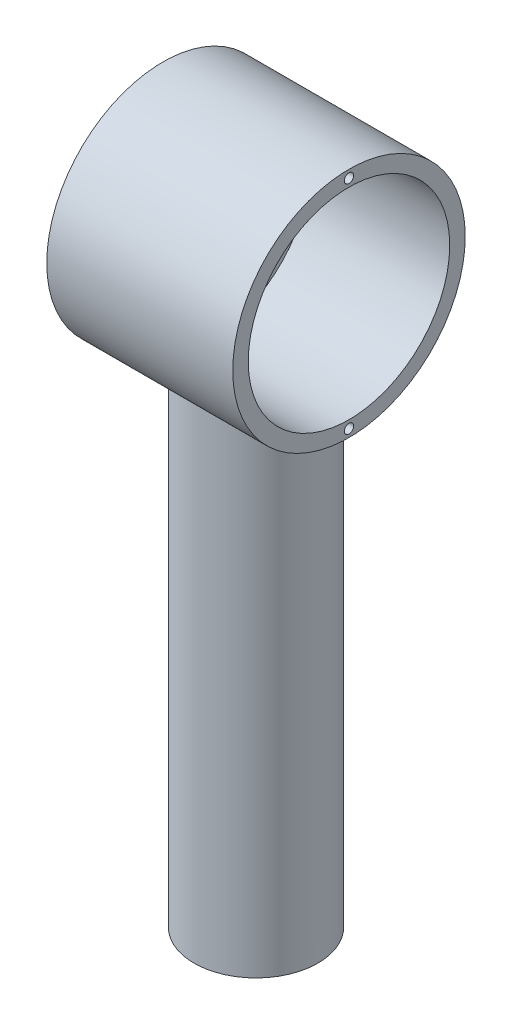
from build123d import *

# Parameters (mm, degrees)
SKETCH1_R                 = 20
BOSS_EXTRUDE1_DEPTH       = 25
BOSS_EXTRUDE2_START       = 100
SKETCH2_R                 = 20
BOSS_EXTRUDE2_DEPTH       = 100
BOSS_EXTRUDE4_START       = -100
SKETCH6_R                 = 20
BOSS_EXTRUDE4_DEPTH       = 100
SKETCH7_R                 = 25
CUT_EXTRUDE2_DEPTH        = 40
SKETCH8_R                 = 25
SKETCH8_R_2               = 22.5
BOSS_EXTRUDE7_DEPTH       = 40
SKETCH9_R                 = 25
BOSS_EXTRUDE8_DEPTH       = 2
BOSS_EXTRUDE10_DEPTH      = 38
CUT_EXTRUDE3_DEPTH        = 25
SKETCH12_R                = 25
CUT_EXTRUDE4_DEPTH        = 75
BOSS_EXTRUDE11_START      = 50
SKETCH14_R                = 20
BOSS_EXTRUDE11_DEPTH      = 50
BOSS_EXTRUDE12_DEPTH      = 10
BOSS_EXTRUDE12_DEPTH_BACK = 50
SKETCH13_R                = 37.5
SKETCH17_R                = 32.5
CUT_EXTRUDE5_DEPTH        = 50
BOSS_EXTRUDE13_START      = 2
SKETCH18_R                = 37.5
SKETCH18_R_2              = 32.5
BOSS_EXTRUDE13_DEPTH      = 2
SKETCH21_R                = 37.5
SKETCH21_R_2              = 32.5
CUT_EXTRUDE6_DEPTH        = 2
SKETCH22_R                = 1.5
CUT_EXTRUDE7_DEPTH        = 10
BOSS_EXTRUDE14_START      = 5
SKETCH27_R                = 32.5
BOSS_EXTRUDE14_DEPTH      = 5


with BuildPart() as part:
    # Sketch1 → Boss-Extrude1 (new body)
    with BuildSketch(Plane(origin=(0, 0, 0), x_dir=(1, 0, 0), z_dir=(0, 1, 0))):
        with Locations(Location((0, 0, 0), (0, 0, 270))):
            Circle(SKETCH1_R)
        Polygon((14.43375673, 0), (7.216878365, 12.5), (-7.216878365, 12.5), (-14.43375673, 0), (-7.216878365, -12.5), (7.216878365, -12.5), align=None, mode=Mode.SUBTRACT)
    extrude(amount=BOSS_EXTRUDE1_DEPTH)

    # Sketch2 → Boss-Extrude2 (add)
    with BuildSketch(Plane.XZ.offset(BOSS_EXTRUDE2_START)):
        with Locations(Location((0, 0, 0), (0, 0, 270))):
            Circle(SKETCH2_R)
    extrude(amount=-BOSS_EXTRUDE2_DEPTH)

    # Sketch6 → Boss-Extrude4 (add)
    with BuildSketch(Plane(origin=(0, 25, 0), x_dir=(1, 0, 0), z_dir=(0, 1, 0)).offset(BOSS_EXTRUDE4_START)):
        with Locations(Location((0, 0, 0), (0, 0, 90))):
            Circle(SKETCH6_R)
    extrude(amount=BOSS_EXTRUDE4_DEPTH)

    # Sketch7 → Cut-Extrude2 (cut)
    with BuildSketch(Plane(origin=(20, 0, 0), x_dir=(0, 0, -1), z_dir=(1, 0, 0))):
        with Locations((0, 39.286563349)):
            Circle(SKETCH7_R)
    extrude(amount=-CUT_EXTRUDE2_DEPTH, mode=Mode.SUBTRACT)

    # Sketch8 → Boss-Extrude7 (add)
    with BuildSketch(Plane(origin=(20, 0, 0), x_dir=(0, 0, -1), z_dir=(1, 0, 0))):
        with Locations((0, 39.252781264)):
            Circle(SKETCH8_R)
        with Locations((0, 39.252781264)):
            Circle(SKETCH8_R_2, mode=Mode.SUBTRACT)
    extrude(amount=-BOSS_EXTRUDE7_DEPTH)

    # Sketch9 → Boss-Extrude8 (add)
    with BuildSketch(Plane(origin=(20, 0, 0), x_dir=(0, 0, -1), z_dir=(1, 0, 0))):
        with Locations((0, 39.252781264)):
            Circle(SKETCH9_R)
    extrude(amount=-BOSS_EXTRUDE8_DEPTH)

    # Sketch10 → Boss-Extrude10 (add)
    with BuildSketch(Plane.ZY.offset(-18)):
        with BuildLine():
            Line((-15.081099266, 22.555163323), (15.081099266, 22.555163323))
            ThreePointArc((15.081099266, 22.555163323), (0, 16.752781264), (-15.081099266, 22.555163323))
        make_face()
    extrude(amount=BOSS_EXTRUDE10_DEPTH)

    # Sketch11 → Cut-Extrude3 (cut)
    with BuildSketch(Plane.XZ.offset(100)):
        Polygon((12.5, 7.216878365), (0, 14.43375673), (0, 0), (12.5, 0), align=None)
        Polygon((0, 0), (0, 14.43375673), (-12.5, 7.216878365), (-12.5, -7.216878365), (0, -14.43375673), (12.5, -7.216878365), (12.5, 0), align=None)
    extrude(amount=-CUT_EXTRUDE3_DEPTH, mode=Mode.SUBTRACT)

    # Sketch12 → Cut-Extrude4 (cut)
    with BuildSketch(Plane(origin=(20, 0, 0), x_dir=(0, 0, -1), z_dir=(1, 0, 0))):
        with Locations((0, 39.252781264)):
            Circle(SKETCH12_R)
    extrude(amount=-CUT_EXTRUDE4_DEPTH, mode=Mode.SUBTRACT)

    # Sketch14 → Boss-Extrude11 (add)
    with BuildSketch(Plane.XZ.offset(100).offset(BOSS_EXTRUDE11_START)):
        with Locations(Location((0, 0, 0), (0, 0, 270))):
            Circle(SKETCH14_R)
        Polygon((0, -14.43375673), (12.5, -7.216878365), (12.5, 7.216878365), (0, 14.43375673), (-12.5, 7.216878365), (-12.5, -7.216878365), align=None, mode=Mode.SUBTRACT)
    extrude(amount=-BOSS_EXTRUDE11_DEPTH)

    # Sketch13 → Boss-Extrude12 (add, two sides: drawn at the far end of the back side and taken through both)
    with BuildSketch(Plane(origin=(20, 0, 0), x_dir=(0, 0, -1), z_dir=(1, 0, 0)).offset(-BOSS_EXTRUDE12_DEPTH_BACK)):
        with Locations((0, 39.33472939)):
            Circle(SKETCH13_R)
    extrude(amount=BOSS_EXTRUDE12_DEPTH + BOSS_EXTRUDE12_DEPTH_BACK)

    # Sketch17 → Cut-Extrude5 (cut)
    with BuildSketch(Plane(origin=(30, 0, 0), x_dir=(0, 0, -1), z_dir=(1, 0, 0))):
        with Locations((0, 39.33472939)):
            Circle(SKETCH17_R)
    extrude(amount=-CUT_EXTRUDE5_DEPTH, mode=Mode.SUBTRACT)

    # Sketch18 → Boss-Extrude13 (add)
    with BuildSketch(Plane(origin=(30, 0, 0), x_dir=(0, 0, -1), z_dir=(1, 0, 0)).offset(BOSS_EXTRUDE13_START)):
        with Locations((0, 39.33472939)):
            Circle(SKETCH18_R)
        with Locations((0, 39.33472939)):
            Circle(SKETCH18_R_2, mode=Mode.SUBTRACT)
    extrude(amount=-BOSS_EXTRUDE13_DEPTH)

    # Sketch21 → Cut-Extrude6 (cut)
    with BuildSketch(Plane(origin=(32, 0, 0), x_dir=(0, 0, -1), z_dir=(1, 0, 0))):
        with Locations((0, 39.33472939)):
            Circle(SKETCH21_R)
        with Locations((0, 39.33472939)):
            Circle(SKETCH21_R_2, mode=Mode.SUBTRACT)
    extrude(amount=-CUT_EXTRUDE6_DEPTH, mode=Mode.SUBTRACT)

    # Sketch22 → Cut-Extrude7 (cut)
    with BuildSketch(Plane(origin=(30, 0, 0), x_dir=(0, 0, -1), z_dir=(1, 0, 0))):
        with Locations((0, 74.33472939)):
            Circle(SKETCH22_R)
        with Locations((0, 4.33472939)):
            Circle(SKETCH22_R)
    extrude(amount=-CUT_EXTRUDE7_DEPTH, mode=Mode.SUBTRACT)

    # Sketch27 → Boss-Extrude14 (add)
    with BuildSketch(Plane(origin=(-20, 0, 0), x_dir=(0, 0, -1), z_dir=(1, 0, 0)).offset(BOSS_EXTRUDE14_START)):
        with Locations((0, 39.33472939)):
            Circle(SKETCH27_R)
    extrude(amount=-BOSS_EXTRUDE14_DEPTH)


solid = part.part
